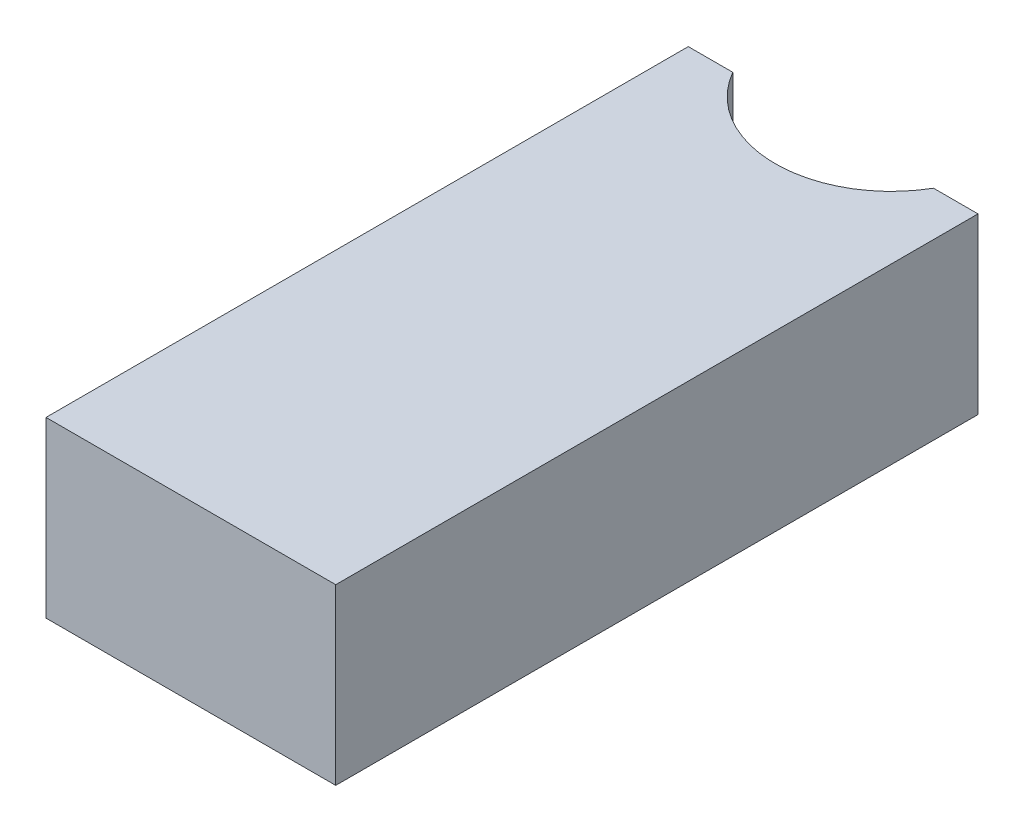
from build123d import *

# Parameters (mm, degrees)
SKETCH1_W           = 31.75
SKETCH1_H           = 19.05
BOSS_EXTRUDE1_DEPTH = 70.3834
SKETCH2_R           = 12.7
CUT_EXTRUDE1_DEPTH  = 75.623998288


with BuildPart() as part:
    # Sketch1 → Boss-Extrude1 (new body)
    with BuildSketch(Plane.XY):
        Rectangle(SKETCH1_W, SKETCH1_H)
    extrude(amount=BOSS_EXTRUDE1_DEPTH)

    # Sketch2 → Cut-Extrude1 (cut, through all)
    with BuildSketch(Plane(origin=(0, 9.525, 0), x_dir=(1, 0, 0), z_dir=(0, 1, 0))):
        with Locations((0, 6.35)):
            Circle(SKETCH2_R)
    extrude(amount=-CUT_EXTRUDE1_DEPTH, mode=Mode.SUBTRACT)


solid = part.part
